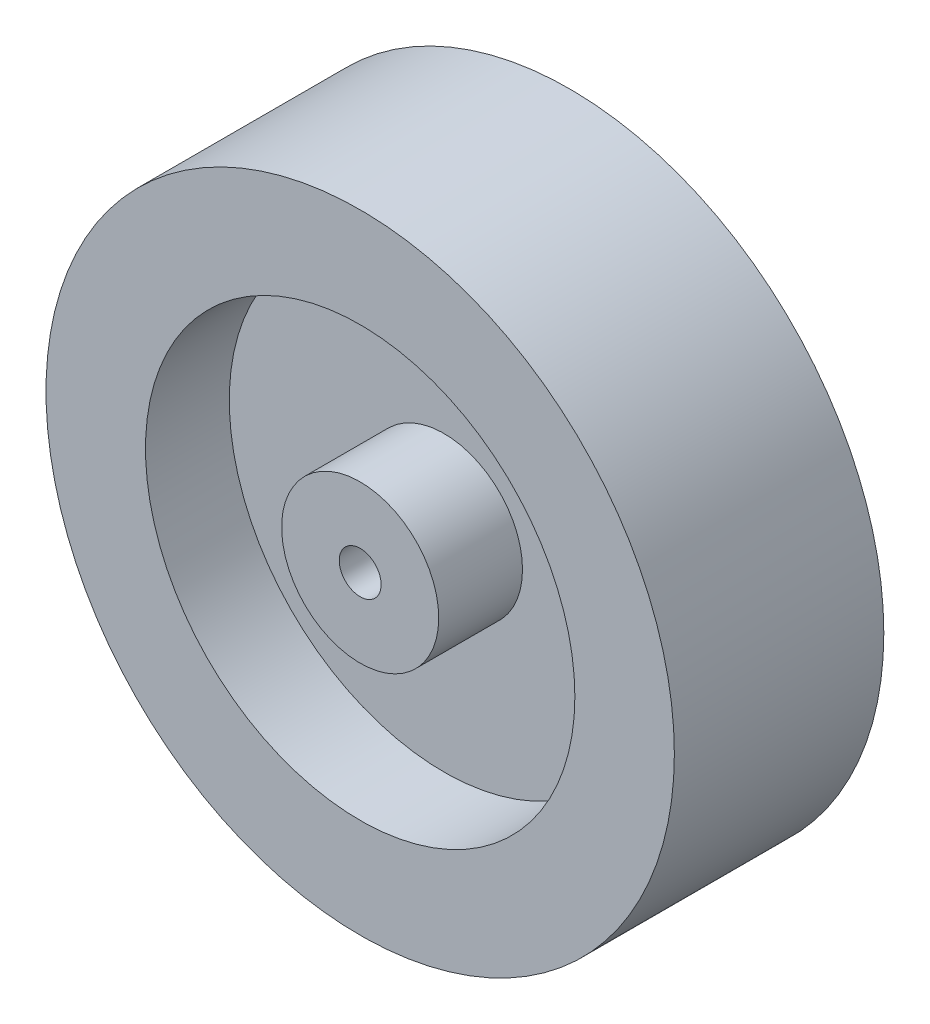
from build123d import *

# Parameters (mm, degrees)
ESBO_O1_R                = 15
ESBO_O1_R_2              = 1
RESSALTO_EXTRUS_O1_DEPTH = 10
ESBO_O2_R                = 10.25
ESBO_O2_R_2              = 3.75
CORTE_EXTRUS_O1_DEPTH    = 4


with BuildPart() as part:
    # Esboço1 → Ressalto-extrusão1 (new body)
    with BuildSketch(Plane.XY):
        Circle(ESBO_O1_R)
        Circle(ESBO_O1_R_2, mode=Mode.SUBTRACT)
    extrude(amount=RESSALTO_EXTRUS_O1_DEPTH)

    # Esboço2 → Corte-extrusão1 (cut)
    with BuildSketch(Plane.XY.offset(10)):
        Circle(ESBO_O2_R)
        Circle(ESBO_O2_R_2, mode=Mode.SUBTRACT)
    extrude(amount=-CORTE_EXTRUS_O1_DEPTH, mode=Mode.SUBTRACT)


solid = part.part
